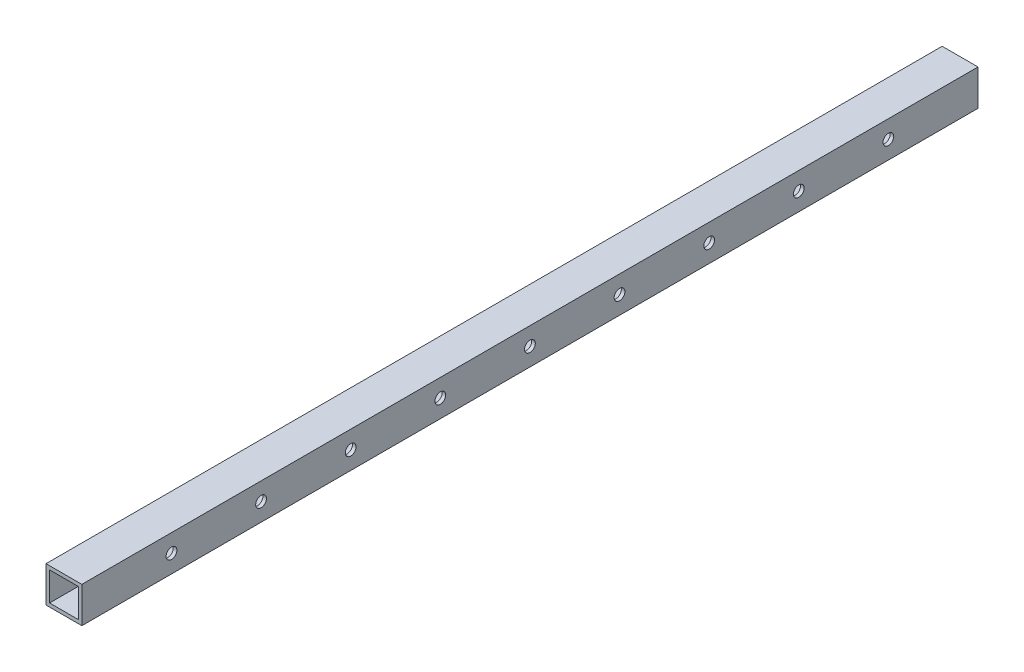
from build123d import *

# Parameters (mm, degrees)
SKETCH1_W           = 20
SKETCH1_H           = 20
SKETCH1_W_2         = 16
SKETCH1_H_2         = 16
BOSS_EXTRUDE1_DEPTH = 500
SKETCH3_R           = 3
CUT_EXTRUDE1_DEPTH  = 501.49975025
LPATTERN1_COUNT     = 9
LPATTERN1_PITCH     = 50


with BuildPart() as part:
    # Sketch1 → Boss-Extrude1 (new body)
    with BuildSketch(Plane.XY):
        Rectangle(SKETCH1_W, SKETCH1_H)
        Rectangle(SKETCH1_W_2, SKETCH1_H_2, mode=Mode.SUBTRACT)
    extrude(amount=BOSS_EXTRUDE1_DEPTH)

    # Sketch3 → Cut-Extrude1 (cut, through all)
    with BuildSketch(Plane.ZY.offset(10)):
        with Locations(Location((50, 0, 0), (0, 0, 270))):
            Circle(SKETCH3_R)
    cut_extrude1 = extrude(amount=-CUT_EXTRUDE1_DEPTH, mode=Mode.SUBTRACT)

    # LPattern1: Cut-Extrude1 ×9
    with Locations(*[(0, 0, i * LPATTERN1_PITCH) for i in range(1, LPATTERN1_COUNT)]):
        add(cut_extrude1, mode=Mode.SUBTRACT)


solid = part.part
